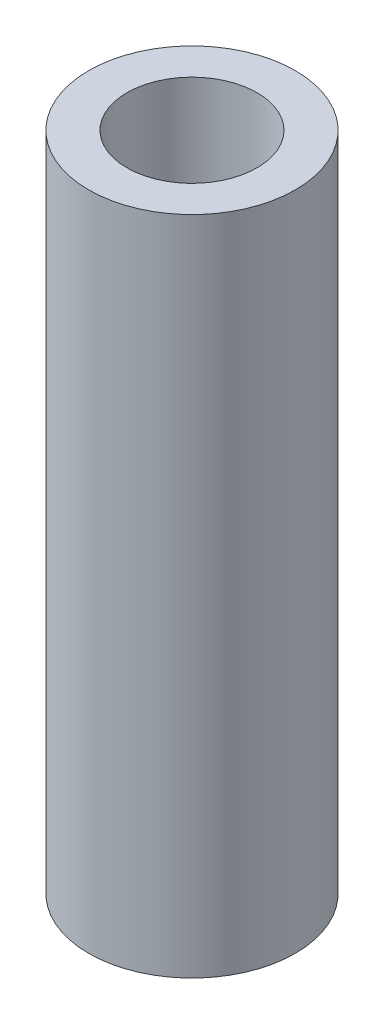
from build123d import *

# Parameters (mm, degrees)
SKETCH2_R           = 3.175
SKETCH2_R_2         = 2
BOSS_EXTRUDE1_DEPTH = 20.32


with BuildPart() as part:
    # Sketch2 → Boss-Extrude1 (new body)
    with BuildSketch(Plane(origin=(0, 0, 0), x_dir=(1, 0, 0), z_dir=(0, 1, 0))):
        with Locations(Location((0, 0, 0), (0, 0, 270))):
            Circle(SKETCH2_R)
        with Locations(Location((0, 0, 0), (0, 0, 270))):
            Circle(SKETCH2_R_2, mode=Mode.SUBTRACT)
    extrude(amount=-BOSS_EXTRUDE1_DEPTH)


solid = part.part
